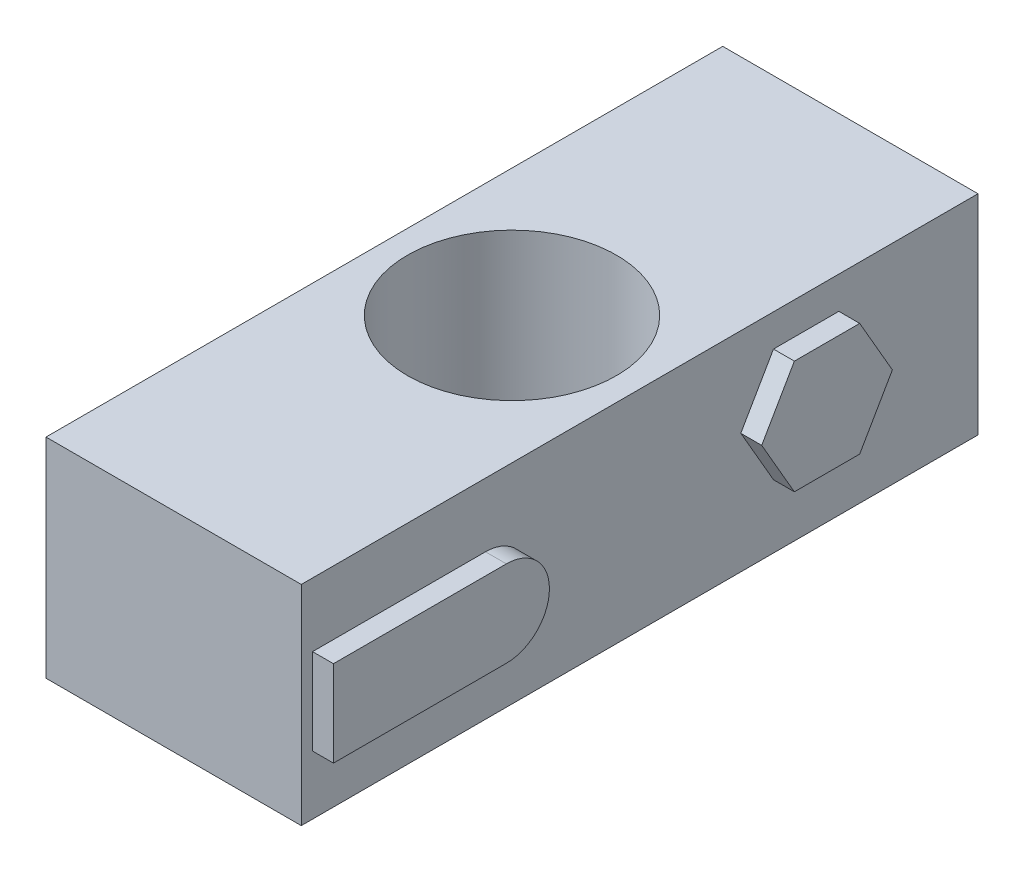
from build123d import *

# Parameters (mm, degrees)
SKETCH1_W           = 12220
SKETCH1_H           = 10000
BOSS_EXTRUDE2_DEPTH = 32393
SKETCH2_R           = 5000
CUT_EXTRUDE1_DEPTH  = 48107.362321948
SKETCH6_W           = 8277.049727591
SKETCH6_H           = 4121.904282014
BOSS_EXTRUDE3_DEPTH = 1000
BOSS_EXTRUDE4_DEPTH = 1000


with BuildPart() as part:
    # Sketch1 → Boss-Extrude2 (new body)
    with BuildSketch(Plane.XY):
        with Locations((-28020.860622764, 11297.128627885)):
            Rectangle(SKETCH1_W, SKETCH1_H)
    extrude(amount=BOSS_EXTRUDE2_DEPTH)

    # Sketch2 → Cut-Extrude1 (cut, through all)
    with BuildSketch(Plane(origin=(0, 16297.128627885, 0), x_dir=(1, 0, 0), z_dir=(0, 1, 0))):
        with Locations(Location((-28020.860622764, -16196.5, 0), (0, 0, 270))):
            Circle(SKETCH2_R)
    extrude(amount=-CUT_EXTRUDE1_DEPTH, mode=Mode.SUBTRACT)

    # Sketch6 → Boss-Extrude3 (add)
    with BuildSketch(Plane(origin=(-21910.860622764, 0, 0), x_dir=(0, 0, -1), z_dir=(1, 0, 0))):
        with Locations((-27714.563175142, 11180.784555409)):
            Rectangle(SKETCH6_W, SKETCH6_H)
        with BuildLine():
            ThreePointArc((-23576.038311346, 13241.736696416), (-21515.086170339, 11180.784555409), (-23576.038311346, 9119.832414402))
            Line((-23576.038311346, 9119.832414402), (-23576.038311346, 13241.736696416))
        make_face()
    extrude(amount=BOSS_EXTRUDE3_DEPTH)

    # Sketch7 → Boss-Extrude4 (add)
    with BuildSketch(Plane(origin=(-21910.860622764, 0, 0), x_dir=(0, 0, -1), z_dir=(1, 0, 0))):
        Polygon((-5098.608311025, 12044.164639286), (-6662.412231117, 14752.75248196), (-9790.020071301, 14752.75248196), (-11353.823991393, 12044.164639286), (-9790.020071301, 9335.576796611), (-6662.412231117, 9335.576796611), align=None)
    extrude(amount=BOSS_EXTRUDE4_DEPTH)


solid = part.part
